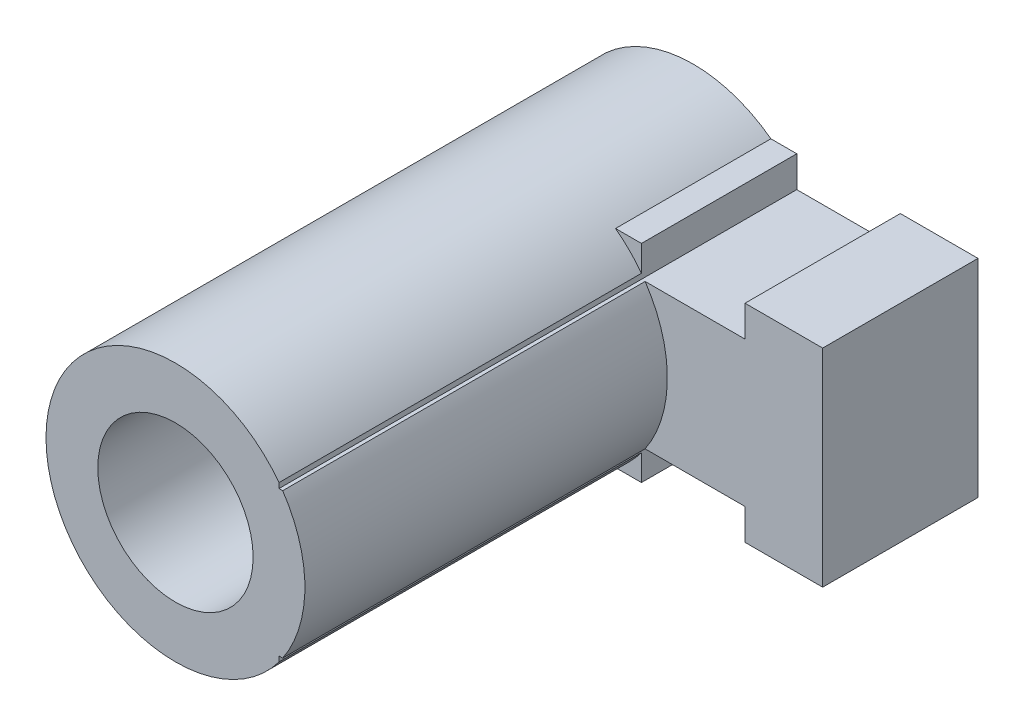
from build123d import *

# Parameters (mm, degrees)
SKETCH_1_R          = 2.5
SKETCH_1_R_2        = 1.5
EXTRUDE_1_DEPTH     = 10
SKETCH_2_W          = 4
SKETCH_2_H          = 4
EXTRUDE_2_DEPTH     = 3
SKETCH_3_W          = 2
SKETCH_3_H          = 0.6
CUT_EXTRUDE_1_DEPTH = 12.683321446


with BuildPart() as part:
    # 草图1 → 凸台-拉伸1 (new body)
    with BuildSketch(Plane.XY):
        Circle(SKETCH_1_R)
        Circle(SKETCH_1_R_2, mode=Mode.SUBTRACT)
    extrude(amount=EXTRUDE_1_DEPTH)

    # 草图2 → 凸台-拉伸2 (add)
    with BuildSketch(Plane(origin=(0, 0, 0), x_dir=(-1, 0, 0), z_dir=(0, 0, -1))):
        with Locations((-3.5, 0)):
            Rectangle(SKETCH_2_W, SKETCH_2_H)
    extrude(amount=-EXTRUDE_2_DEPTH)

    # 草图3 → 切除-拉伸1 (cut, through all)
    with BuildSketch(Plane(origin=(0, 0, 0), x_dir=(-1, 0, 0), z_dir=(0, 0, -1))):
        with Locations((-3, -1.7)):
            Rectangle(SKETCH_3_W, SKETCH_3_H)
        with Locations((-3, 1.7)):
            Rectangle(SKETCH_3_W, SKETCH_3_H)
    extrude(amount=-CUT_EXTRUDE_1_DEPTH, mode=Mode.SUBTRACT)


solid = part.part
